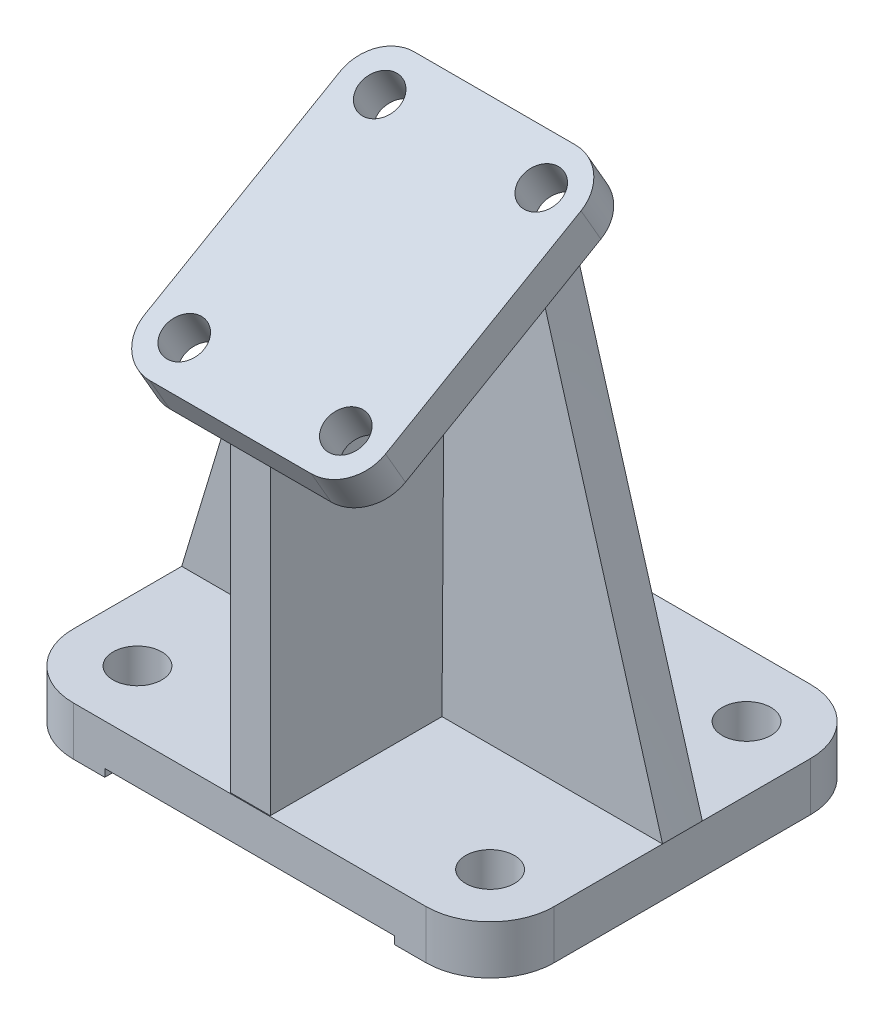
from build123d import *

# Parameters (mm, degrees)
SKETCH1_W               = 95.25
SKETCH1_H               = 76.2
BOSS_EXTRUDE1_DEPTH     = 9.652
FILLET1_R               = 12.7
CUT_EXTRUDE1_DEPTH      = 62.74877917
CUT_EXTRUDE1_DEPTH_BACK = 62.74877917
SKETCH2_R               = 4.826
SKETCH3_W               = 57.404
SKETCH3_H               = 3.048
CUT_EXTRUDE2_DEPTH      = 91.375559356
SKETCH5_W               = 60.452
SKETCH5_H               = 47.752
BOSS_EXTRUDE2_DEPTH     = 7.874
FILLET2_R               = 7.874
SKETCH6_R               = 3.937
CUT_EXTRUDE3_DEPTH      = 7.874
RIB1_REACH              = 125.976
SKETCH10_WALL_W         = 309.953649084
SKETCH10_WALL_H         = 7.874


with BuildPart() as part:
    # Sketch1 → Boss-Extrude1 (new body)
    with BuildSketch(Plane(origin=(0, 0, 0), x_dir=(1, 0, 0), z_dir=(0, 1, 0))):
        Rectangle(SKETCH1_W, SKETCH1_H)
    extrude(amount=BOSS_EXTRUDE1_DEPTH)

    # Fillet1
    fillet1_edges = [part.edges().sort_by_distance(p)[0] for p in [
        (47.625, 4.826, 38.1),
        (-47.625, 4.826, 38.1),
        (-47.625, 4.826, -38.1),
        (47.625, 4.826, -38.1),
    ]]
    fillet(fillet1_edges, radius=FILLET1_R)

    # Sketch2 → Cut-Extrude1 (cut, two sides: drawn at the far end of the back side and taken through both)
    with BuildSketch(Plane(origin=(0, 9.652, 0), x_dir=(1, 0, 0), z_dir=(0, 1, 0)).offset(-CUT_EXTRUDE1_DEPTH_BACK)):
        with Locations(Location((-34.925, -25.4, 0), (0, 0, 270))):
            Circle(SKETCH2_R)
        with Locations(Location((-34.925, 25.4, 0), (0, 0, 270))):
            Circle(SKETCH2_R)
        with Locations(Location((34.925, 25.4, 0), (0, 0, 270))):
            Circle(SKETCH2_R)
        with Locations(Location((34.925, -25.4, 0), (0, 0, 270))):
            Circle(SKETCH2_R)
    extrude(amount=CUT_EXTRUDE1_DEPTH + CUT_EXTRUDE1_DEPTH_BACK, mode=Mode.SUBTRACT)

    # Sketch3 → Cut-Extrude2 (cut, through all)
    with BuildSketch(Plane.XY.offset(38.1)):
        Rectangle(SKETCH3_W, SKETCH3_H)
    extrude(amount=-CUT_EXTRUDE2_DEPTH, mode=Mode.SUBTRACT)



with BuildPart() as body_2:
    # Sketch5 → Boss-Extrude2 (new body)
    with BuildSketch(Plane(origin=(0, 68.540427062, 39.571834015), x_dir=(0, 0.4999999999999976, -0.86602540378444), z_dir=(0, -0.8660254037844402, -0.4999999999999977))):
        with Locations((32.114183863, 0)):
            Rectangle(SKETCH5_W, SKETCH5_H)
    extrude(amount=-BOSS_EXTRUDE2_DEPTH)

    # Fillet2
    fillet2_edges = [body_2.edges().sort_by_distance(p)[0] for p in [
        (-23.876, 103.120061008, -12.447848887),
        (-23.876, 72.894061008, 39.905118823),
        (23.876, 72.894061008, 39.905118823),
        (23.876, 103.120061008, -12.447848887),
    ]]
    fillet(fillet2_edges, radius=FILLET2_R)

    # Sketch6 → Cut-Extrude3 (cut)
    with BuildSketch(Plane(origin=(0, 75.359511091, 43.508834015), x_dir=(1, 0, 0), z_dir=(0, 0.86602540378444, 0.49999999999999784))):
        with Locations(Location((-16.002, 9.762183863, 0), (0, 0, 270))):
            Circle(SKETCH6_R)
        with Locations(Location((16.002, 9.762183863, 0), (0, 0, 270))):
            Circle(SKETCH6_R)
        with Locations(Location((16.002, 54.466183863, 0), (0, 0, 270))):
            Circle(SKETCH6_R)
        with Locations(Location((-16.002, 54.466183863, 0), (0, 0, 270))):
            Circle(SKETCH6_R)
    extrude(amount=-CUT_EXTRUDE3_DEPTH, mode=Mode.SUBTRACT)


with BuildPart() as part_1:
    add(part.part)

    add(body_2.part)  # Loft1 merges body 2
    # Sketch9 → Loft1 section 0
    with BuildSketch(Plane(origin=(0, 68.540427062, 39.571834015), x_dir=(1, 0, 0), z_dir=(0, -0.86602540378444, -0.49999999999999784))):
        with BuildLine():
            Line((23.876, -49.630618041), (-23.876, -49.630618041))
            Line((-23.876, -49.630618041), (-23.876, -41.756618041))
            Line((-23.876, -41.756618041), (23.876, -41.756618041))
            Line((23.876, -41.756618041), (23.876, -49.630618041))
        make_face()
    # Sketch7 → Loft1 section 1
    with BuildSketch(Plane(origin=(0, 9.652, 0), x_dir=(1, 0, 0), z_dir=(0, 1, 0))):
        with BuildLine():
            Line((-47.625, -3.937), (47.625, -3.937))
            Line((47.625, -3.937), (47.625, 3.937))
            Line((47.625, 3.937), (-47.625, 3.937))
            Line((-47.625, 3.937), (-47.625, -3.937))
        make_face()
    loft()

    # Sketch10 wall → Rib1 (add, up to next)
    with BuildSketch(Plane(origin=(0, 39.483889376, 37.936618823), x_dir=(0, 1, 0), z_dir=(0, 0, 1)), mode=Mode.PRIVATE) as rib1_sk1:
        Rectangle(SKETCH10_WALL_W, SKETCH10_WALL_H)
    rib1_tool1 = extrude(rib1_sk1.sketch, amount=-RIB1_REACH, mode=Mode.PRIVATE) - part_1.part
    add(rib1_tool1.solids().sort_by_distance((0, 39.483889376, 37.936618823))[0])


solid = part_1.part
